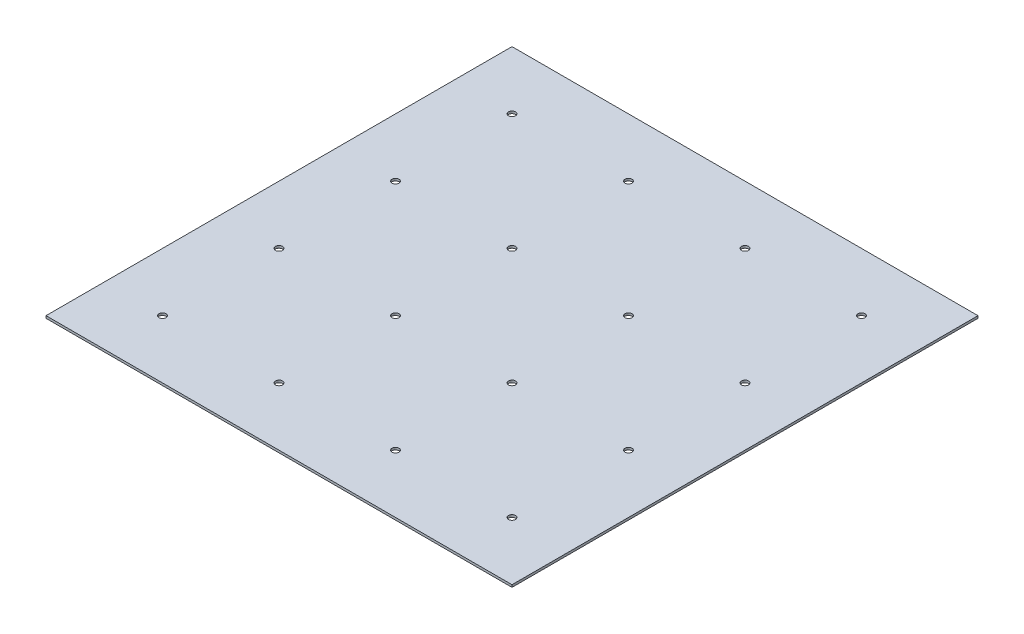
from build123d import *

# Parameters (mm, degrees)
SKETCH1_W           = 400
SKETCH1_H           = 400
BOSS_EXTRUDE1_DEPTH = 2
SKETCH2_R           = 3
CUT_EXTRUDE1_DEPTH  = 283.849783454


with BuildPart() as part:
    # Sketch1 → Boss-Extrude1 (new body)
    with BuildSketch(Plane(origin=(0, 0, 0), x_dir=(1, 0, 0), z_dir=(0, 1, 0))):
        Rectangle(SKETCH1_W, SKETCH1_H)
    extrude(amount=BOSS_EXTRUDE1_DEPTH)

    # Sketch2 → Cut-Extrude1 (cut, through all)
    with BuildSketch(Plane(origin=(0, 2, 0), x_dir=(1, 0, 0), z_dir=(0, 1, 0))):
        with Locations(Location((-150, 150, 0), (0, 0, 270))):
            Circle(SKETCH2_R)
        with Locations(Location((-50, 150, 0), (0, 0, 270))):
            Circle(SKETCH2_R)
        with Locations(Location((50, 150, 0), (0, 0, 270))):
            Circle(SKETCH2_R)
        with Locations(Location((150, 150, 0), (0, 0, 270))):
            Circle(SKETCH2_R)
        with Locations(Location((-50, 50, 0), (0, 0, 270))):
            Circle(SKETCH2_R)
        with Locations(Location((50, 50, 0), (0, 0, 270))):
            Circle(SKETCH2_R)
        with Locations(Location((150, 50, 0), (0, 0, 270))):
            Circle(SKETCH2_R)
        with Locations(Location((-50, -50, 0), (0, 0, 270))):
            Circle(SKETCH2_R)
        with Locations(Location((50, -50, 0), (0, 0, 270))):
            Circle(SKETCH2_R)
        with Locations(Location((150, -50, 0), (0, 0, 270))):
            Circle(SKETCH2_R)
        with Locations(Location((-50, -150, 0), (0, 0, 270))):
            Circle(SKETCH2_R)
        with Locations(Location((50, -150, 0), (0, 0, 270))):
            Circle(SKETCH2_R)
        with Locations(Location((150, -150, 0), (0, 0, 270))):
            Circle(SKETCH2_R)
        with Locations(Location((-150, 50, 0), (0, 0, 270))):
            Circle(SKETCH2_R)
        with Locations(Location((-150, -50, 0), (0, 0, 270))):
            Circle(SKETCH2_R)
        with Locations(Location((-150, -150, 0), (0, 0, 270))):
            Circle(SKETCH2_R)
    extrude(amount=-CUT_EXTRUDE1_DEPTH, mode=Mode.SUBTRACT)


solid = part.part
